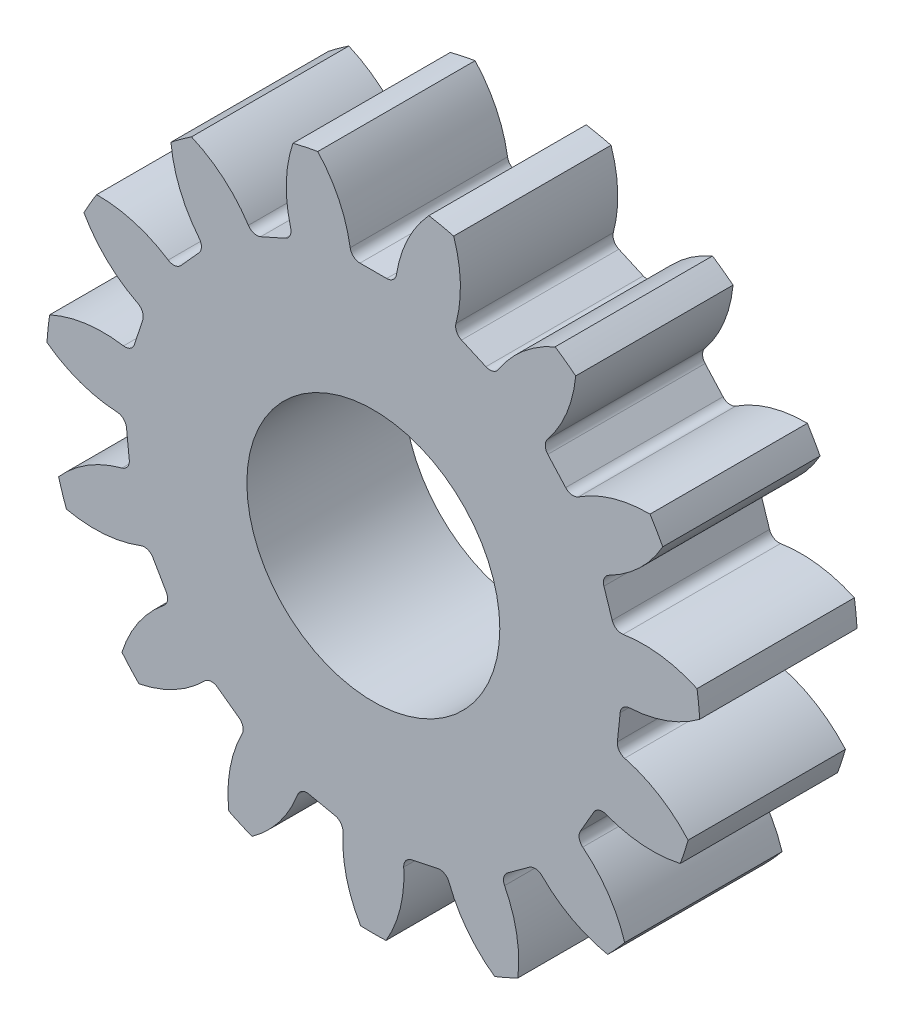
from build123d import *

# Parameters (mm, degrees)
SKETCH1_R                = 6.335999901
BOSS_EXTRUDE1_DEPTH      = 1.524
CUT_EXTRUDE1_DEPTH       = 10.089134474
FILLET1_R                = 0.191999997
CIRPATTERN1_COUNT        = 15
FILLET1_OF_CIRPATTERN1_R = 0.191999997
CUT_EXTRUDE2_DEPTH       = 10.455482489
CUT_EXTRUDE2_DEPTH_BACK  = 10.455482489
SKETCH4_R                = 2.45


with BuildPart() as part:
    # Sketch1 → Boss-Extrude1 (new, symmetric)
    with BuildSketch(Plane.XY):
        with Locations(Location((0, 0, 0), (0, 0, 180))):
            Circle(SKETCH1_R)
    extrude(amount=BOSS_EXTRUDE1_DEPTH, both=True)

    # Sketch3 → Cut-Extrude1 (cut, symmetric)
    with BuildSketch(Plane.XY):
        with BuildLine():
            Line((-0.428414679, 4.780843037), (0.428414679, 4.780843037))
            ThreePointArc((0.428414679, 4.780843037), (1.010780942, 6.170659573), (2.288190337, 6.970012879))
            ThreePointArc((2.288190337, 6.970012879), (0, 7.335999901), (-2.288190337, 6.970012879))
            ThreePointArc((-2.288190337, 6.970012879), (-1.010780942, 6.170659573), (-0.428414679, 4.780843037))
        make_face()
    cut_extrude1 = extrude(amount=CUT_EXTRUDE1_DEPTH, both=True, mode=Mode.SUBTRACT)

    # Fillet1
    fillet1_edges = [part.edges().sort_by_distance(p)[0] for p in [
        (-0.428414679, 4.780843037, 0),
        (0.428414679, 4.780843037, 0),
    ]]
    fillet(fillet1_edges, radius=FILLET1_R)

    # CirPattern1: Cut-Extrude1 ×15 about axis
    cirpattern1_axis = Axis((0, 0, 0), (0, 0, 1))
    for i in range(1, CIRPATTERN1_COUNT):
        add(cut_extrude1.rotate(cirpattern1_axis, i * 360 / CIRPATTERN1_COUNT), mode=Mode.SUBTRACT)

    # Fillet1 of CirPattern1
    fillet1_of_cirpattern1_edges = [part.edges().sort_by_distance(p)[0] for p in [
        (-2.335920332, 4.193265492, 0),
        (-1.553167764, 4.541769388, 0),
        (-3.839524138, 2.880634248, 0),
        (-3.26619339, 3.517382552, 0),
        (-4.67923934, 1.069915174, 0),
        (-4.414464507, 1.884808318, 0),
        (-4.70987155, -0.925801954, 0),
        (-4.799434606, -0.073666397, 0),
        (-3.926124182, -2.761439514, 0),
        (-4.354538861, -2.019403523, 0),
        (-2.463514275, -4.119599094, 0),
        (-3.156703787, -3.615967434, 0),
        (-0.574940369, -4.765442566, 0),
        (-1.41304595, -4.587297726, 0),
        (1.41304595, -4.587297726, 0),
        (0.574940369, -4.765442566, 0),
        (3.156703787, -3.615967434, 0),
        (2.463514275, -4.119599094, 0),
        (4.354538861, -2.019403523, 0),
        (3.926124182, -2.761439514, 0),
        (4.799434606, -0.073666397, 0),
        (4.70987155, -0.925801954, 0),
        (4.414464507, 1.884808318, 0),
        (4.67923934, 1.069915174, 0),
        (3.26619339, 3.517382552, 0),
        (3.839524138, 2.880634248, 0),
        (1.553167764, 4.541769388, 0),
        (2.335920332, 4.193265492, 0),
    ]]
    fillet(fillet1_of_cirpattern1_edges, radius=FILLET1_OF_CIRPATTERN1_R)

    # Sketch4 → Cut-Extrude2 (cut, two sides: drawn at the far end of the back side and taken through both)
    with BuildSketch(Plane.XY.offset(1.524).offset(-CUT_EXTRUDE2_DEPTH_BACK)):
        Circle(SKETCH4_R)
    extrude(amount=CUT_EXTRUDE2_DEPTH + CUT_EXTRUDE2_DEPTH_BACK, mode=Mode.SUBTRACT)


solid = part.part
